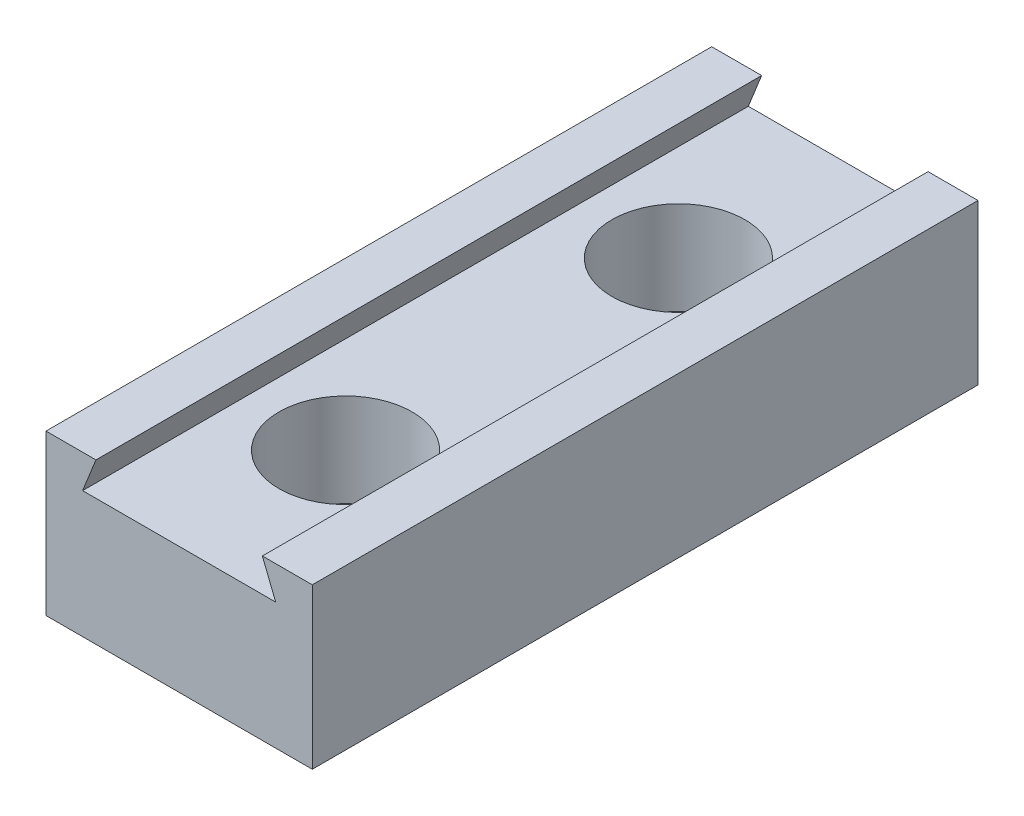
from build123d import *

# Parameters (mm, degrees)
SKETCH1_W           = 20
SKETCH1_H           = 50
BOSS_EXTRUDE1_DEPTH = 12
CUT_EXTRUDE1_REACH  = 54.383
SKETCH3_R           = 5
CUT_EXTRUDE3_DEPTH  = 7
CUT_EXTRUDE4_REACH  = 30.553
SKETCH4_R           = 2.25


with BuildPart() as part:
    # Sketch1 → Boss-Extrude1 (new body)
    with BuildSketch(Plane(origin=(0, 0, 0), x_dir=(1, 0, 0), z_dir=(0, 1, 0))):
        Rectangle(SKETCH1_W, SKETCH1_H)
    extrude(amount=BOSS_EXTRUDE1_DEPTH)

    # Sketch2 → Cut-Extrude1 (cut, up to next)
    with BuildSketch(Plane.XY.offset(25), mode=Mode.PRIVATE) as cut_extrude1_sk1:
        Polygon((0, 9.5), (7.25, 9.5), (6.25, 12), (0, 12), (-6.25, 12), (-7.25, 9.5), align=None)
    cut_extrude1_tool1 = extrude(cut_extrude1_sk1.sketch, amount=-CUT_EXTRUDE1_REACH, mode=Mode.PRIVATE) & part.part
    add(cut_extrude1_tool1.solids().sort_by_distance((0, 10.719136, 25))[0], mode=Mode.SUBTRACT)

    # Sketch3 → Cut-Extrude3 (cut)
    with BuildSketch(Plane(origin=(0, 9.5, 0), x_dir=(1, 0, 0), z_dir=(0, 1, 0))):
        with Locations(Location((0, 12.5, 0), (0, 0, 270))):
            Circle(SKETCH3_R)
        with Locations(Location((0, -12.5, 0), (0, 0, 270))):
            Circle(SKETCH3_R)
    extrude(amount=-CUT_EXTRUDE3_DEPTH, mode=Mode.SUBTRACT)

    # Sketch4 → Cut-Extrude4 (cut, up to next)
    with BuildSketch(Plane(origin=(0, 2.5, 0), x_dir=(1, 0, 0), z_dir=(0, 1, 0)), mode=Mode.PRIVATE) as cut_extrude4_sk1:
        with Locations(Location((0, 12.5, 0), (0, 0, 270))):
            Circle(SKETCH4_R)
    cut_extrude4_tool1 = extrude(cut_extrude4_sk1.sketch, amount=-CUT_EXTRUDE4_REACH, mode=Mode.PRIVATE) & part.part
    # Sketch4 → Cut-Extrude4 (cut, up to next)
    with BuildSketch(Plane(origin=(0, 2.5, 0), x_dir=(1, 0, 0), z_dir=(0, 1, 0)), mode=Mode.PRIVATE) as cut_extrude4_sk2:
        with Locations(Location((0, -12.5, 0), (0, 0, 270))):
            Circle(SKETCH4_R)
    cut_extrude4_tool2 = extrude(cut_extrude4_sk2.sketch, amount=-CUT_EXTRUDE4_REACH, mode=Mode.PRIVATE) & part.part
    add(cut_extrude4_tool1.solids().sort_by_distance((0, 2.5, -12.5))[0], mode=Mode.SUBTRACT)
    add(cut_extrude4_tool2.solids().sort_by_distance((0, 2.5, 12.5))[0], mode=Mode.SUBTRACT)


solid = part.part
